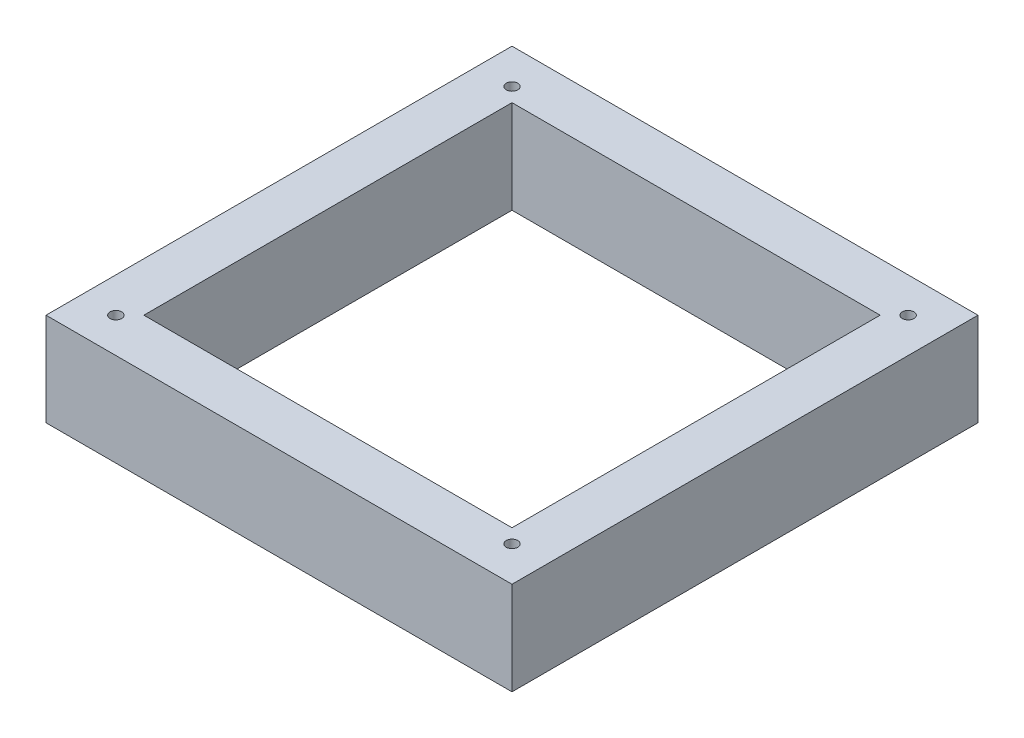
from build123d import *

# Parameters (mm, degrees)
CROQUIS1_W              = 200
CROQUIS1_H              = 200
CROQUIS1_R              = 2.5
CROQUIS1_W_2            = 158
CROQUIS1_H_2            = 158
SALIENTE_EXTRUIR1_DEPTH = 40


with BuildPart() as part:
    # Croquis1 → Saliente-Extruir1 (new body)
    with BuildSketch(Plane(origin=(0, 0, 0), x_dir=(1, 0, 0), z_dir=(0, 1, 0))):
        with Locations((100, 100)):
            Rectangle(CROQUIS1_W, CROQUIS1_H)
        with Locations(Location((185, 185, 0), (0, 0, 270))):
            Circle(CROQUIS1_R, mode=Mode.SUBTRACT)
        with Locations(Location((185, 15, 0), (0, 0, 270))):
            Circle(CROQUIS1_R, mode=Mode.SUBTRACT)
        with Locations(Location((15, 15, 0), (0, 0, 270))):
            Circle(CROQUIS1_R, mode=Mode.SUBTRACT)
        with Locations(Location((15, 185, 0), (0, 0, 270))):
            Circle(CROQUIS1_R, mode=Mode.SUBTRACT)
        with Locations((100, 100)):
            Rectangle(CROQUIS1_W_2, CROQUIS1_H_2, mode=Mode.SUBTRACT)
    extrude(amount=SALIENTE_EXTRUIR1_DEPTH)


solid = part.part
